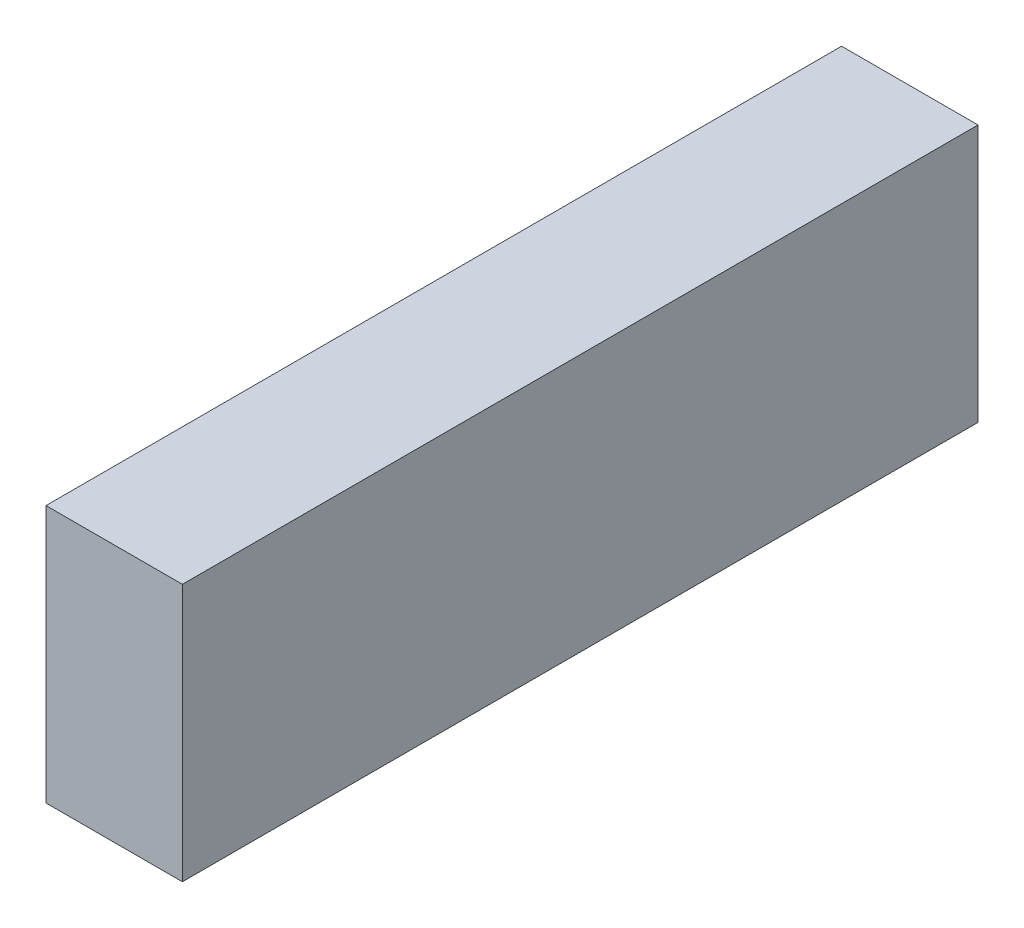
from build123d import *

# Parameters (mm, degrees)
ESQUISSE1_W        = 18
ESQUISSE1_H        = 34
BOSS_EXTRU_1_DEPTH = 105


with BuildPart() as part:
    # Esquisse1 → Boss.-Extru.1 (new body)
    with BuildSketch(Plane.XY):
        with Locations((9, 17)):
            Rectangle(ESQUISSE1_W, ESQUISSE1_H)
    extrude(amount=BOSS_EXTRU_1_DEPTH)


solid = part.part
